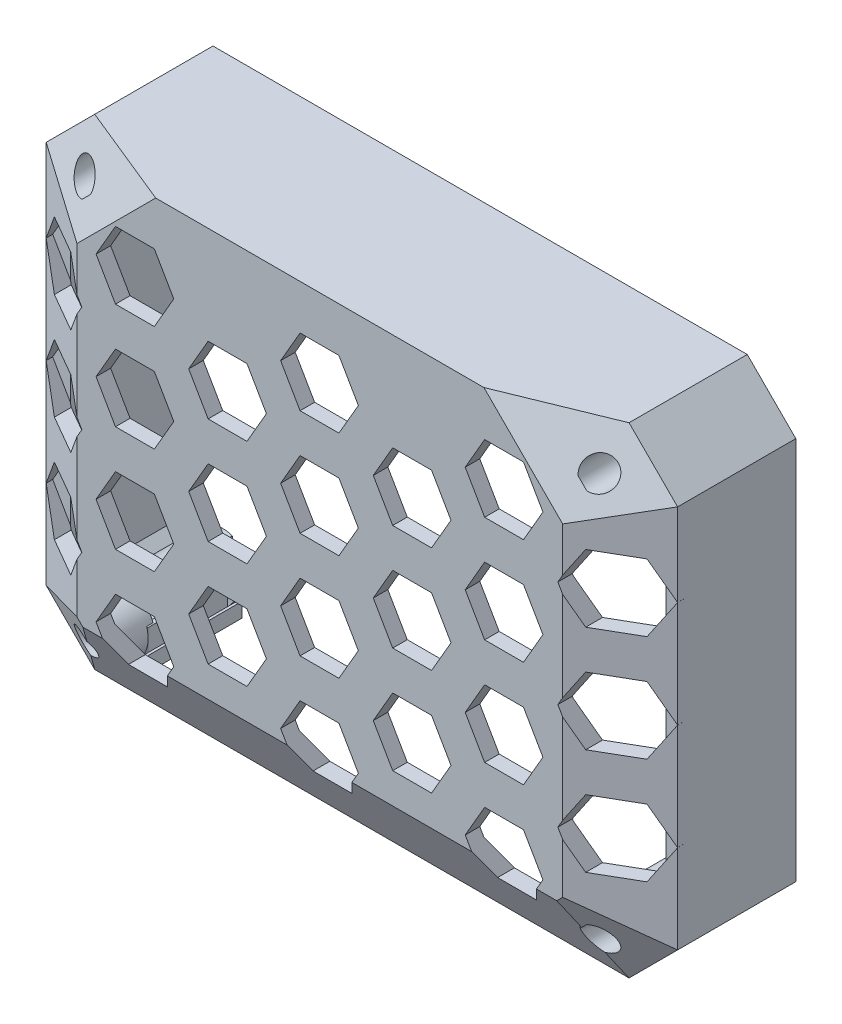
from build123d import *

# Parameters (mm, degrees)
EXTRUDE1_DEPTH     = 33
CHAMFER1_SIZE      = 15
CHAMFER1_SIZE2     = 8.660254038
SKETCH2_R          = 3
CUT_EXTRUDE1_DEPTH = 30
SHELL1_T           = -3
CUT_EXTRUDE2_DEPTH = 10
CUT_EXTRUDE3_DEPTH = 10
SKETCH6_R          = 6
SKETCH6_R_2        = 1.6
EXTRUDE2_DEPTH     = 3
CUT_EXTRUDE4_DEPTH = 20


with BuildPart() as part:
    # Sketch1 → Extrude1 (new body)
    with BuildSketch(Plane.XY):
        Polygon((-9, 72), (-19, 62), (-19, -17), (-9, -27), (101, -27), (111, -17), (111, 62), (101, 72), align=None)
    extrude(amount=EXTRUDE1_DEPTH)

    # Chamfer1
    chamfer1_edges = [part.edges().sort_by_distance(p)[0] for p in [
        (-19, 22.5, 33),
        (-14, -22, 33),
        (46, -27, 33),
        (106, -22, 33),
        (111, 22.5, 33),
        (106, 67, 33),
        (-14, 67, 33),
    ]]
    chamfer1_side = [part.faces().sort_by_distance(p)[0] for p in [
        (46, 22.5, 33),
    ]]
    chamfer(chamfer1_edges, length=CHAMFER1_SIZE, length2=CHAMFER1_SIZE2, reference=chamfer1_side[0])

    # Sketch2 → Cut-Extrude1 (cut)
    with BuildSketch(Plane(origin=(0, 0, 0), x_dir=(-1, 0, 0), z_dir=(0, 0, -1))):
        with Locations((-99, 64)):
            Circle(SKETCH2_R)
        with Locations((7, 64)):
            Circle(SKETCH2_R)
        with Locations((7, -19)):
            Circle(SKETCH2_R)
        with Locations((-99, -19)):
            Circle(SKETCH2_R)
    extrude(amount=-CUT_EXTRUDE1_DEPTH, mode=Mode.SUBTRACT)

    # Shell1
    shell1_openings = [part.faces().sort_by_distance(p)[0] for p in [
        (46, 22.5, 0),
    ]]
    offset(amount=SHELL1_T, openings=shell1_openings)

    # Sketch3 → Cut-Extrude2 (cut)
    with BuildSketch(Plane.XY.offset(33)):
        Polygon((15.931966954, 34.013676287), (11.931966954, 40.941879517), (3.931966954, 40.941879517), (-0.068033046, 34.013676287), (3.931966954, 27.085473057), (11.931966954, 27.085473057), align=None)
        Polygon((-2.996236276, 23.085473057), (-6.996236276, 30.013676287), (-14.996236276, 30.013676287), (-18.996236276, 23.085473057), (-14.996236276, 16.157269827), (-6.996236276, 16.157269827), align=None)
        Polygon((15.931966954, 12.157269827), (11.931966954, 19.085473057), (3.931966954, 19.085473057), (-0.068033046, 12.157269827), (3.931966954, 5.229066596), (11.931966954, 5.229066596), align=None)
        Polygon((11.931966954, 62.798285978), (15.931966954, 55.870082748), (11.931966954, 48.941879517), (3.931966954, 48.941879517), (-0.068033046, 55.870082748), (3.931966954, 62.798285978), align=None)
        Polygon((-2.996236276, 1.229066596), (-6.996236276, 8.157269827), (-14.996236276, 8.157269827), (-18.996236276, 1.229066596), (-14.996236276, -5.699136634), (-6.996236276, -5.699136634), align=None)
        Polygon((15.931966954, -9.699136634), (11.931966954, -2.770933404), (3.931966954, -2.770933404), (-0.068033046, -9.699136634), (3.931966954, -16.627339864), (11.931966954, -16.627339864), align=None)
        Polygon((53.931966954, 34.013676287), (49.931966954, 40.941879517), (41.931966954, 40.941879517), (37.931966954, 34.013676287), (41.931966954, 27.085473057), (49.931966954, 27.085473057), align=None)
        Polygon((-2.996236276, 44.941879517), (-6.996236276, 51.870082748), (-14.996236276, 51.870082748), (-18.996236276, 44.941879517), (-14.996236276, 38.013676287), (-6.996236276, 38.013676287), align=None)
        Polygon((35.003763724, 23.085473057), (31.003763724, 30.013676287), (23.003763724, 30.013676287), (19.003763724, 23.085473057), (23.003763724, 16.157269827), (31.003763724, 16.157269827), align=None)
        Polygon((53.931966954, 12.157269827), (49.931966954, 19.085473057), (41.931966954, 19.085473057), (37.931966954, 12.157269827), (41.931966954, 5.229066596), (49.931966954, 5.229066596), align=None)
        Polygon((49.931966954, 62.798285978), (53.931966954, 55.870082748), (49.931966954, 48.941879517), (41.931966954, 48.941879517), (37.931966954, 55.870082748), (41.931966954, 62.798285978), align=None)
        Polygon((35.003763724, 1.229066596), (31.003763724, 8.157269827), (23.003763724, 8.157269827), (19.003763724, 1.229066596), (23.003763724, -5.699136634), (31.003763724, -5.699136634), align=None)
        Polygon((53.931966954, -9.699136634), (49.931966954, -2.770933404), (41.931966954, -2.770933404), (37.931966954, -9.699136634), (41.931966954, -16.627339864), (49.931966954, -16.627339864), align=None)
        Polygon((35.003763724, 44.941879517), (31.003763724, 51.870082748), (23.003763724, 51.870082748), (19.003763724, 44.941879517), (23.003763724, 38.013676287), (31.003763724, 38.013676287), align=None)
        Polygon((91.931966954, 34.013676287), (87.931966954, 40.941879517), (79.931966954, 40.941879517), (75.931966954, 34.013676287), (79.931966954, 27.085473057), (87.931966954, 27.085473057), align=None)
        Polygon((73.003763724, 23.085473057), (69.003763724, 30.013676287), (61.003763724, 30.013676287), (57.003763724, 23.085473057), (61.003763724, 16.157269827), (69.003763724, 16.157269827), align=None)
        Polygon((91.931966954, 12.157269827), (87.931966954, 19.085473057), (79.931966954, 19.085473057), (75.931966954, 12.157269827), (79.931966954, 5.229066596), (87.931966954, 5.229066596), align=None)
        Polygon((87.931966954, 62.798285978), (91.931966954, 55.870082748), (87.931966954, 48.941879517), (79.931966954, 48.941879517), (75.931966954, 55.870082748), (79.931966954, 62.798285978), align=None)
        Polygon((73.003763724, 1.229066596), (69.003763724, 8.157269827), (61.003763724, 8.157269827), (57.003763724, 1.229066596), (61.003763724, -5.699136634), (69.003763724, -5.699136634), align=None)
        Polygon((91.931966954, -9.699136634), (87.931966954, -2.770933404), (79.931966954, -2.770933404), (75.931966954, -9.699136634), (79.931966954, -16.627339864), (87.931966954, -16.627339864), align=None)
        Polygon((73.003763724, 44.941879517), (69.003763724, 51.870082748), (61.003763724, 51.870082748), (57.003763724, 44.941879517), (61.003763724, 38.013676287), (69.003763724, 38.013676287), align=None)
        Polygon((111.003763724, 23.085473057), (107.003763724, 30.013676287), (99.003763724, 30.013676287), (95.003763724, 23.085473057), (99.003763724, 16.157269827), (107.003763724, 16.157269827), align=None)
        Polygon((111.003763724, 1.229066596), (107.003763724, 8.157269827), (99.003763724, 8.157269827), (95.003763724, 1.229066596), (99.003763724, -5.699136634), (107.003763724, -5.699136634), align=None)
        Polygon((111.003763724, 44.941879517), (107.003763724, 51.870082748), (99.003763724, 51.870082748), (95.003763724, 44.941879517), (99.003763724, 38.013676287), (107.003763724, 38.013676287), align=None)
    extrude(amount=-CUT_EXTRUDE2_DEPTH, mode=Mode.SUBTRACT)

    # Sketch5 → Cut-Extrude3 (cut)
    with BuildSketch(Plane.XZ.offset(27)):
        with BuildLine():
            Line((-1, 21.339745962), (93, 21.339745962))
            ThreePointArc((93, 21.339745962), (94.414213562, 20.753959525), (95, 19.339745962))
            Line((95, 19.339745962), (95, -14.31546611))
            ThreePointArc((95, -14.31546611), (94.414213562, -15.729679672), (93, -16.31546611))
            Line((93, -16.31546611), (-1, -16.31546611))
            ThreePointArc((-1, -16.31546611), (-2.414213562, -15.729679672), (-3, -14.31546611))
            Line((-3, -14.31546611), (-3, 19.339745962))
            ThreePointArc((-3, 19.339745962), (-2.414213562, 20.753959525), (-1, 21.339745962))
        make_face()
    extrude(amount=-CUT_EXTRUDE3_DEPTH, mode=Mode.SUBTRACT)

    # Sketch6 → Extrude2 (add)
    # profile 1 of 4: a face of its own
    with BuildSketch(Plane(origin=(0, 0, 0), x_dir=(-1, 0, 0), z_dir=(0, 0, -1))):
        with Locations((-99, 64)):
            Circle(SKETCH6_R)
        with Locations((-99, 64)):
            Circle(SKETCH6_R_2, mode=Mode.SUBTRACT)
    # profile 2 of 4: a face of its own
    with BuildSketch(Plane(origin=(0, 0, 0), x_dir=(-1, 0, 0), z_dir=(0, 0, -1))):
        with Locations((7, 64)):
            Circle(SKETCH6_R)
        with Locations((7, 64)):
            Circle(SKETCH6_R_2, mode=Mode.SUBTRACT)
    # profile 3 of 4: a face of its own
    with BuildSketch(Plane(origin=(0, 0, 0), x_dir=(-1, 0, 0), z_dir=(0, 0, -1))):
        with Locations((7, -19)):
            Circle(SKETCH6_R)
        with Locations((7, -19)):
            Circle(SKETCH6_R_2, mode=Mode.SUBTRACT)
    # profile 4 of 4: a face of its own
    with BuildSketch(Plane(origin=(0, 0, 0), x_dir=(-1, 0, 0), z_dir=(0, 0, -1))):
        with Locations((-99, -19)):
            Circle(SKETCH6_R)
        with Locations((-99, -19)):
            Circle(SKETCH6_R_2, mode=Mode.SUBTRACT)
    extrude(amount=-EXTRUDE2_DEPTH)

    # Sketch7 → Cut-Extrude4 (cut)
    with BuildSketch(Plane(origin=(0, 0, 0), x_dir=(-1, 0, 0), z_dir=(0, 0, -1))):
        with BuildLine():
            Line((-96, 63), (4, 63))
            ThreePointArc((4, 63), (4.707106781, 62.707106781), (5, 62))
            Line((5, 62), (5, -18))
            ThreePointArc((5, -18), (4.707106781, -18.707106781), (4, -19))
            Line((4, -19), (-96, -19))
            ThreePointArc((-96, -19), (-96.707106781, -18.707106781), (-97, -18))
            Line((-97, -18), (-97, 62))
            ThreePointArc((-97, 62), (-96.707106781, 62.707106781), (-96, 63))
        make_face()
    extrude(amount=-CUT_EXTRUDE4_DEPTH, mode=Mode.SUBTRACT)


solid = part.part
